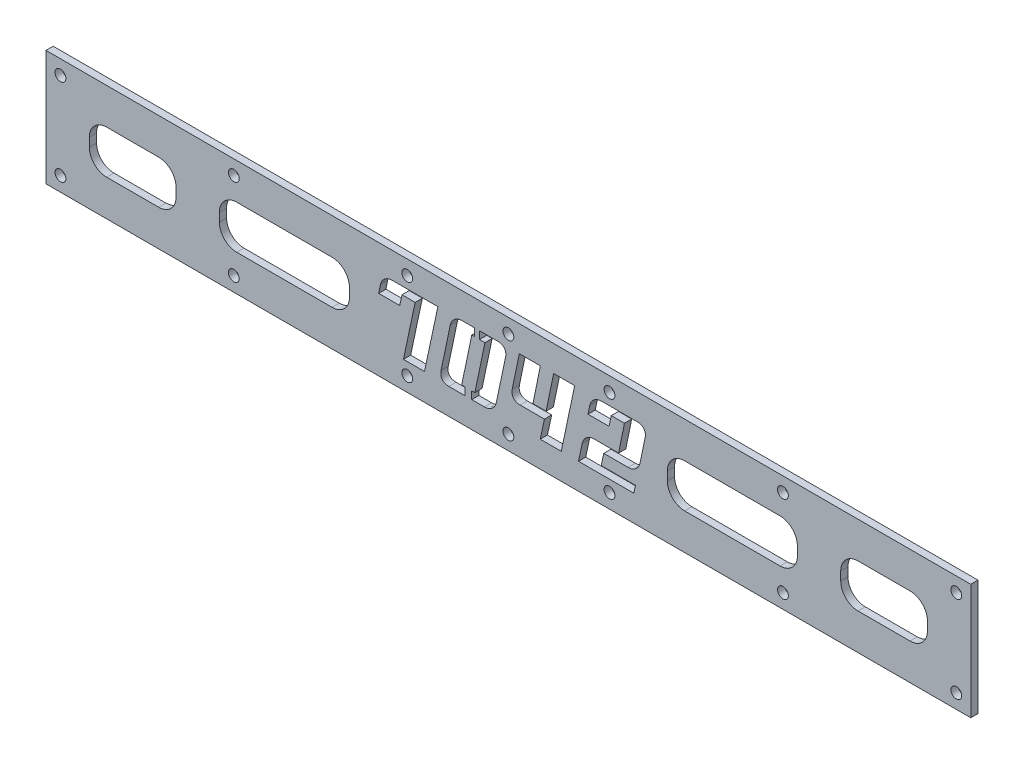
from build123d import *

# Parameters (mm, degrees)
SKETCH1_W           = 406.4
SKETCH1_H           = 50.8
BOSS_EXTRUDE1_DEPTH = 3.175
CUT_EXTRUDE1_DEPTH  = 3.175
SKETCH3_W           = 2.215865989
SKETCH3_H           = 11.434056402
SKETCH3_W_2         = 3.011470772
SKETCH3_H_2         = 11.828237792
BOSS_EXTRUDE2_DEPTH = 3.175
SKETCH4_W           = 38.1
SKETCH4_H           = 19.05
SKETCH4_W_2         = 57.15
CUT_EXTRUDE2_DEPTH  = 3.175
FILLET1_R           = 7.62
SKETCH5_R           = 2.38125
CUT_EXTRUDE3_DEPTH  = 43.18


with BuildPart() as part:
    # Sketch1 → Boss-Extrude1 (new body)
    with BuildSketch(Plane.XY):
        Rectangle(SKETCH1_W, SKETCH1_H)
    extrude(amount=BOSS_EXTRUDE1_DEPTH)

    # Sketch2 → Cut-Extrude1 (cut)
    # profile 1 of 4: a face of its own
    with BuildSketch(Plane.XY.offset(3.175)):
        with BuildLine():
            Line((-36.867994167, -13.644033333), (-46.117298333, -13.644033333))
            Line((-46.117298333, -13.644033333), (-40.971681667, 10.6172))
            Line((-40.971681667, 10.6172), (-46.763410833, 10.6172))
            Line((-46.763410833, 10.6172), (-47.729669167, 6.030383333))
            Line((-47.729669167, 6.030383333), (-56.984794167, 6.030383333))
            Line((-56.984794167, 6.030383333), (-56.216444167, 9.773179167))
            add(Edge.make_bspline(
                [(-56.216444167, 9.773179167), (-56.131865964, 10.081601767), (-55.967254438, 10.681873625), (-55.547155016, 11.506299627), (-55.006723453, 12.23416071), (-54.338720404, 12.847664454), (-53.586390074, 13.350909531), (-52.757702658, 13.708044964), (-51.872485623, 13.933857625), (-51.260411886, 13.95780167), (-50.94859, 13.97)],
                knots=[0, 0, 0, 0, 1.050168006, 2.043904372, 3.024673376, 4.01863537, 5.013909092, 5.989008141, 6.975497172, 8, 8, 8, 8], degree=3))
            Line((-50.94859, 13.97), (-30.9889525, 13.97))
            Line((-30.9889525, 13.97), (-36.867994167, -13.644033333))
        make_face()
    # profile 2 of 4: a face of its own
    with BuildSketch(Plane.XY.offset(3.175)):
        with BuildLine():
            add(Edge.make_bspline(
                [(-5.282988333, -9.598554167), (-5.367888901, -9.916404361), (-5.533558628, -10.536637609), (-5.949976256, -11.393417277), (-6.49166619, -12.151347302), (-7.157225064, -12.792301149), (-7.90563745, -13.322251338), (-8.733057542, -13.698209918), (-9.622702294, -13.927984846), (-10.237068629, -13.95579605), (-10.5508425, -13.97)],
                knots=[0, 0, 0, 0, 1.062369753, 2.073042759, 3.062499936, 4.061251344, 5.048575831, 6.014824268, 6.986115874, 8, 8, 8, 8], degree=3))
            Line((-10.5508425, -13.97), (-26.1623175, -13.97))
            add(Edge.make_bspline(
                [(-26.1623175, -13.97), (-26.321631065, -13.967468441), (-26.629774239, -13.962571916), (-27.075773741, -13.901584417), (-27.490871658, -13.809162314), (-27.877619522, -13.683832514), (-28.228577923, -13.513106765), (-28.548396527, -13.307310145), (-28.834211965, -13.06229423), (-29.083934327, -12.780656589), (-29.303137009, -12.473198465), (-29.469540947, -12.131510872), (-29.601378964, -11.769226691), (-29.677540985, -11.38052777), (-29.730412648, -10.969866939), (-29.717481743, -10.532547199), (-29.672896212, -10.071034009), (-29.611018822, -9.759183753), (-29.579146667, -9.598554167)],
                knots=[0, 0, 0, 0, 1.158779845, 2.241303809, 3.269110906, 4.251580925, 5.192683609, 6.101443689, 7.012833415, 7.922909267, 8.835720222, 9.751475912, 10.680528402, 11.633319635, 12.628295421, 13.687540584, 14.808885378, 16, 16, 16, 16], degree=3))
            Line((-29.579146667, -9.598554167), (-25.556950833, 9.598554167))
            add(Edge.make_bspline(
                [(-25.556950833, 9.598554167), (-25.472045994, 9.916398172), (-25.306367931, 10.536619344), (-24.890010076, 11.393485608), (-24.348099279, 12.151095657), (-23.682215235, 12.794359024), (-22.929216925, 13.32053961), (-22.101251217, 13.698491647), (-21.213255317, 13.927409362), (-20.600897496, 13.955630394), (-20.289096667, 13.97)],
                knots=[0, 0, 0, 0, 1.062516124, 2.073328378, 3.062921881, 4.061810895, 5.05442655, 6.020808115, 6.992233544, 8, 8, 8, 8], degree=3))
            Line((-20.289096667, 13.97), (-4.677621667, 13.97))
            add(Edge.make_bspline(
                [(-4.677621667, 13.97), (-4.518308122, 13.96746843), (-4.210164987, 13.962571886), (-3.764165208, 13.901584525), (-3.349068267, 13.809161936), (-2.962316996, 13.683833836), (-2.611370543, 13.513102124), (-2.29150917, 13.30732685), (-2.005852602, 13.06223164), (-1.755537001, 12.780890096), (-1.538049241, 12.471601523), (-1.36302825, 12.133211275), (-1.233841716, 11.768936059), (-1.153994092, 11.381009137), (-1.113797683, 10.969424423), (-1.113700535, 10.53259529), (-1.162028503, 10.071017269), (-1.223373658, 9.759178062), (-1.254971667, 9.598554167)],
                knots=[0, 0, 0, 0, 1.158432062, 2.24063113, 3.268129752, 4.250304904, 5.191125136, 6.099612471, 7.010728663, 7.920531375, 8.833068369, 9.75494936, 10.683723015, 11.636228288, 12.62940148, 13.688234619, 14.809242866, 16, 16, 16, 16], degree=3))
            Line((-1.254971667, 9.598554167), (-5.282988333, -9.598554167))
        make_face()
        Polygon((-16.1039175, 10.6172), (-20.527750833, -10.6172), (-14.736021667, -10.6172), (-10.312188333, 10.6172), align=None, mode=Mode.SUBTRACT)
    # profile 3 of 4: a face of its own
    with BuildSketch(Plane.XY.offset(3.175)):
        with BuildLine():
            Line((14.072446667, 13.97), (10.772034167, -2.048933333))
            Line((10.772034167, -2.048933333), (16.569584167, -2.048933333))
            Line((16.569584167, -2.048933333), (19.869996667, 13.97))
            Line((19.869996667, 13.97), (29.119300833, 13.97))
            Line((29.119300833, 13.97), (23.24608, -13.97))
            Line((23.24608, -13.97), (13.990955, -13.97))
            Line((13.990955, -13.97), (15.84198, -5.401733333))
            Line((15.84198, -5.401733333), (5.143288333, -5.401733333))
            add(Edge.make_bspline(
                [(5.143288333, -5.401733333), (4.983956523, -5.399255382), (4.675778059, -5.394462546), (4.230025759, -5.332748716), (3.813447162, -5.242744072), (3.429166554, -5.10819518), (3.076904272, -4.93945503), (2.757127791, -4.733196616), (2.469760989, -4.486086218), (2.21533411, -4.202506061), (1.998578968, -3.888116915), (1.82854369, -3.544540691), (1.699655053, -3.179152247), (1.621425565, -2.787192605), (1.56961051, -2.372438696), (1.581946958, -1.931294511), (1.627399854, -1.465987089), (1.688822469, -1.152119638), (1.720638333, -0.989541667)],
                knots=[0, 0, 0, 0, 1.152191709, 2.228561082, 3.250524676, 4.231939746, 5.167691878, 6.071285285, 6.977493388, 7.902223819, 8.821393841, 9.731943086, 10.66895861, 11.616332835, 12.619603957, 13.686867372, 14.801836863, 16, 16, 16, 16], degree=3))
            Line((1.720638333, -0.989541667), (4.817321667, 13.97))
            Line((4.817321667, 13.97), (14.072446667, 13.97))
        make_face()
    # profile 4 of 4: a face of its own
    with BuildSketch(Plane.XY.offset(3.175)):
        with BuildLine():
            Line((40.791235833, -10.6172), (55.83809, -10.6172))
            Line((55.83809, -10.6172), (55.110485833, -13.97))
            Line((55.110485833, -13.97), (30.8143275, -13.97))
            Line((30.8143275, -13.97), (32.461623333, -6.309783333))
            add(Edge.make_bspline(
                [(32.461623333, -6.309783333), (32.546441127, -5.999546402), (32.711972881, -5.394083075), (33.130608375, -4.559691129), (33.67080126, -3.820085909), (34.338954391, -3.19541477), (35.089591381, -2.679131877), (35.920138251, -2.317532052), (36.806620936, -2.082980883), (37.421391598, -2.06044191), (37.735298333, -2.048933333)],
                knots=[0, 0, 0, 0, 1.049169808, 2.047576474, 3.031944376, 4.027910562, 5.023553593, 5.994653504, 6.976054309, 8, 8, 8, 8], degree=3))
            Line((37.735298333, -2.048933333), (48.43399, -2.048933333))
            Line((48.43399, -2.048933333), (51.006798333, 10.6172))
            Line((51.006798333, 10.6172), (45.215069167, 10.6172))
            Line((45.215069167, 10.6172), (44.248810833, 6.030383333))
            Line((44.248810833, 6.030383333), (34.993685833, 6.030383333))
            Line((34.993685833, 6.030383333), (35.762035833, 9.773179167))
            add(Edge.make_bspline(
                [(35.762035833, 9.773179167), (35.846614036, 10.081601767), (36.011225562, 10.681873625), (36.431324984, 11.506299627), (36.971756547, 12.23416071), (37.639759596, 12.847664454), (38.392089926, 13.350909531), (39.220777342, 13.708044964), (40.105994377, 13.933857625), (40.718068114, 13.95780167), (41.02989, 13.97)],
                knots=[0, 0, 0, 0, 1.050168006, 2.043904372, 3.024673376, 4.01863537, 5.013909092, 5.989008141, 6.975497172, 8, 8, 8, 8], degree=3))
            Line((41.02989, 13.97), (56.641365, 13.97))
            add(Edge.make_bspline(
                [(56.641365, 13.97), (56.800696987, 13.967522214), (57.108875792, 13.962729697), (57.554625702, 13.901013631), (57.971212703, 13.811016848), (58.355463883, 13.67644043), (58.707829046, 13.507796512), (59.027237608, 13.301193955), (59.314996782, 13.056209303), (59.563553954, 12.768920474), (59.779286315, 12.455044906), (59.957601911, 12.114446834), (60.083920566, 11.747149114), (60.16577003, 11.355926556), (60.204942528, 10.94026983), (60.205599862, 10.499607434), (60.156452268, 10.034237434), (60.095557466, 9.720380735), (60.064015, 9.557808333)],
                knots=[0, 0, 0, 0, 1.152517565, 2.229191352, 3.251443972, 4.233136601, 5.169153376, 6.073002333, 6.979466726, 7.895134038, 8.814564014, 9.731738245, 10.66901877, 11.616660927, 12.618740334, 13.686213184, 14.801498005, 16, 16, 16, 16], degree=3))
            Line((60.064015, 9.557808333), (57.887023333, -0.989541667))
            add(Edge.make_bspline(
                [(57.887023333, -0.989541667), (57.801816892, -1.309169404), (57.635103463, -1.934547437), (57.221833862, -2.800479121), (56.678461093, -3.56543181), (56.012853863, -4.211630746), (55.266252797, -4.749342217), (54.435816735, -5.122068408), (53.54833742, -5.361691323), (52.933127225, -5.388203478), (52.619169167, -5.401733333)],
                knots=[0, 0, 0, 0, 1.06412456, 2.082047477, 3.072647496, 4.071792832, 5.058775816, 6.021176094, 6.990153746, 8, 8, 8, 8], degree=3))
            Line((52.619169167, -5.401733333), (41.914656667, -5.401733333))
            Line((41.914656667, -5.401733333), (40.791235833, -10.6172))
        make_face()
    extrude(amount=-CUT_EXTRUDE1_DEPTH, mode=Mode.SUBTRACT)


with BuildPart() as cut_extrude1_piece_1:
    # of the separate pieces the step leaves, piece 1, a body of its own (cut_extrude1_pieces)
    add(part.part.solids().sort_by_distance((-203.2, 25.4, 0))[0])



with BuildPart() as cut_extrude1_piece_2:
    # of the separate pieces the step leaves, piece 2, a body of its own (cut_extrude1_pieces)
    add(part.part.solids().sort_by_distance((-16.1039175, 10.6172, 0))[0])


with BuildPart() as cut_extrude1_piece_1_1:
    add(cut_extrude1_piece_1.part)

    add(cut_extrude1_piece_2.part)  # Boss-Extrude2 merges Cut-Extrude1 piece 2
    # Sketch3 → Boss-Extrude2 (add)
    with BuildSketch(Plane.XY.offset(3.175)):
        with Locations((-13.794438763, 12.594587857)):
            Rectangle(SKETCH3_W, SKETCH3_H)
        with Locations((-17.614423161, -15.751168697)):
            Rectangle(SKETCH3_W_2, SKETCH3_H_2)
    extrude(amount=-BOSS_EXTRUDE2_DEPTH)

    # Sketch4 → Cut-Extrude2 (cut)
    with BuildSketch(Plane.XY.offset(3.175)):
        with Locations((-165.1, 0)):
            Rectangle(SKETCH4_W, SKETCH4_H)
        with Locations((-98.425, 0)):
            Rectangle(SKETCH4_W_2, SKETCH4_H)
        with Locations((98.425, 0)):
            Rectangle(SKETCH4_W_2, SKETCH4_H)
        with Locations((165.1, 0)):
            Rectangle(SKETCH4_W, SKETCH4_H)
    extrude(amount=-CUT_EXTRUDE2_DEPTH, mode=Mode.SUBTRACT)

    # Fillet1
    fillet1_edges = [cut_extrude1_piece_1_1.edges().sort_by_distance(p)[0] for p in [
        (-184.15, -9.525, 1.5875),
        (-184.15, 9.525, 1.5875),
        (-146.05, 9.525, 1.5875),
        (-146.05, -9.525, 1.5875),
        (-127, -9.525, 1.5875),
        (-127, 9.525, 1.5875),
        (-69.85, 9.525, 1.5875),
        (-69.85, -9.525, 1.5875),
        (69.85, 9.525, 1.5875),
        (127, 9.525, 1.5875),
        (127, -9.525, 1.5875),
        (69.85, -9.525, 1.5875),
        (146.05, 9.525, 1.5875),
        (184.15, 9.525, 1.5875),
        (184.15, -9.525, 1.5875),
        (146.05, -9.525, 1.5875),
    ]]
    fillet(fillet1_edges, radius=FILLET1_R)

    # Sketch5 → Cut-Extrude3 (cut)
    with BuildSketch(Plane.XY.offset(3.175)):
        with Locations((-196.85, 19.05)):
            Circle(SKETCH5_R)
        with Locations((-120.65, 19.05)):
            Circle(SKETCH5_R)
        with Locations((-44.45, 19.05)):
            Circle(SKETCH5_R)
        with Locations((0, 19.05)):
            Circle(SKETCH5_R)
        with Locations((44.45, 19.05)):
            Circle(SKETCH5_R)
        with Locations((120.65, 19.05)):
            Circle(SKETCH5_R)
        with Locations((196.85, 19.05)):
            Circle(SKETCH5_R)
        with Locations((196.85, -19.05)):
            Circle(SKETCH5_R)
        with Locations((120.65, -19.05)):
            Circle(SKETCH5_R)
        with Locations((44.45, -19.05)):
            Circle(SKETCH5_R)
        with Locations((0, -19.05)):
            Circle(SKETCH5_R)
        with Locations((-44.45, -19.05)):
            Circle(SKETCH5_R)
        with Locations((-120.65, -19.05)):
            Circle(SKETCH5_R)
        with Locations((-196.85, -19.05)):
            Circle(SKETCH5_R)
    extrude(amount=-CUT_EXTRUDE3_DEPTH, mode=Mode.SUBTRACT)


solid = cut_extrude1_piece_1_1.part
